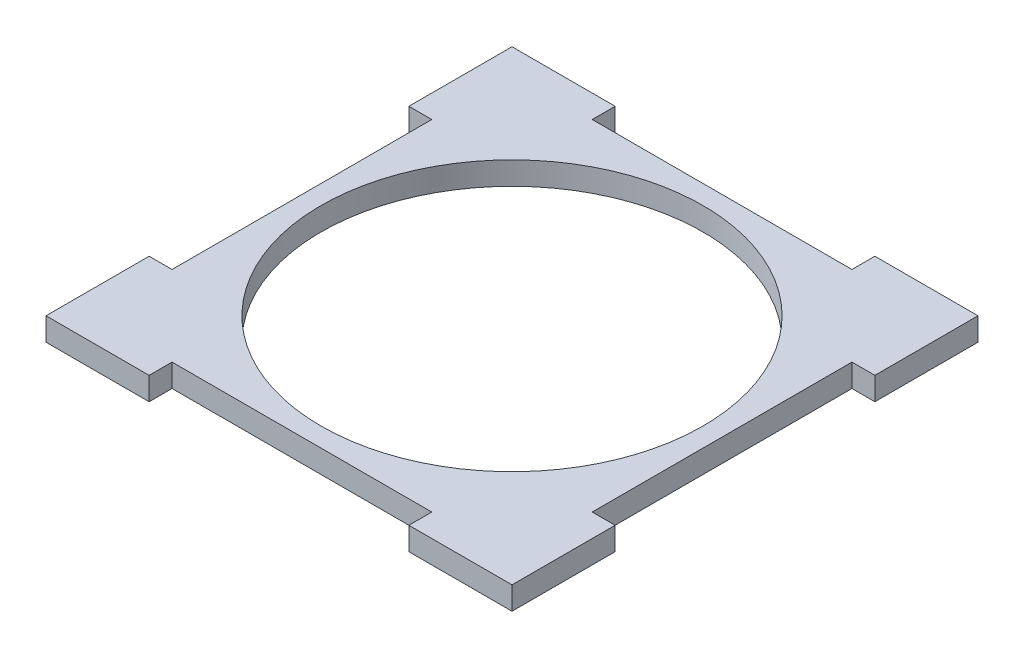
from build123d import *

# Parameters (mm, degrees)
CROQUIS1_R              = 25
SALIENTE_EXTRUIR1_DEPTH = 3


with BuildPart() as part:
    # Croquis1 → Saliente-Extruir1 (new body)
    with BuildSketch(Plane(origin=(0, 0, 0), x_dir=(1, 0, 0), z_dir=(0, 1, 0))):
        Polygon((-27.5, 0), (-27.5, 17), (-30.5, 17), (-30.5, 23.75), (-30.5, 30.5), (-23.75, 30.5), (-17, 30.5), (-17, 27.5), (0, 27.5), (17, 27.5), (17, 30.5), (23.75, 30.5), (30.5, 30.5), (30.5, 23.75), (30.5, 17), (27.5, 17), (27.5, 0), (27.5, -17), (30.5, -17), (30.5, -30.5), (23.75, -30.5), (17, -30.5), (17, -27.5), (0, -27.5), (-17, -27.5), (-17, -30.5), (-23.75, -30.5), (-30.5, -30.5), (-30.5, -23.75), (-30.5, -17), (-27.5, -17), align=None)
        with Locations(Location((0, 0, 0), (0, 0, 270))):
            Circle(CROQUIS1_R, mode=Mode.SUBTRACT)
    extrude(amount=SALIENTE_EXTRUIR1_DEPTH)


solid = part.part
